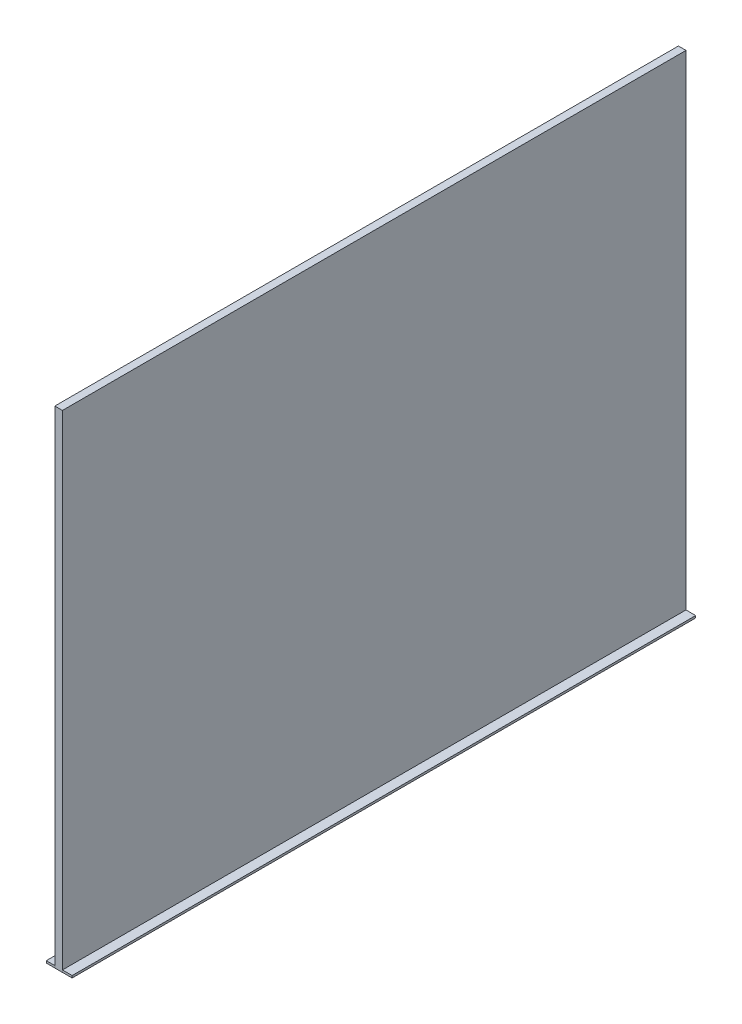
from build123d import *

# Parameters (mm, degrees)
SKETCH_1_W      = 2.5
SKETCH_1_H      = 205
EXTRUDE_1_DEPTH = 160
SKETCH_2_W      = 8.489287285
SKETCH_2_H      = 204.984421923
EXTRUDE_2_DEPTH = 0.7


with BuildPart() as part:
    # 草图1 → 凸台-拉伸1 (new body)
    with BuildSketch(Plane(origin=(0, 0, 0), x_dir=(1, 0, 0), z_dir=(0, 1, 0))):
        with Locations((1.25, -102.5)):
            Rectangle(SKETCH_1_W, SKETCH_1_H)
    extrude(amount=EXTRUDE_1_DEPTH)

    # 草图2 → 凸台-拉伸2 (add)
    with BuildSketch(Plane(origin=(0, 0, 0), x_dir=(1, 0, 0), z_dir=(0, 1, 0))):
        with Locations((1.439606508, -102.492210962)):
            Rectangle(SKETCH_2_W, SKETCH_2_H)
    extrude(amount=EXTRUDE_2_DEPTH)


solid = part.part
